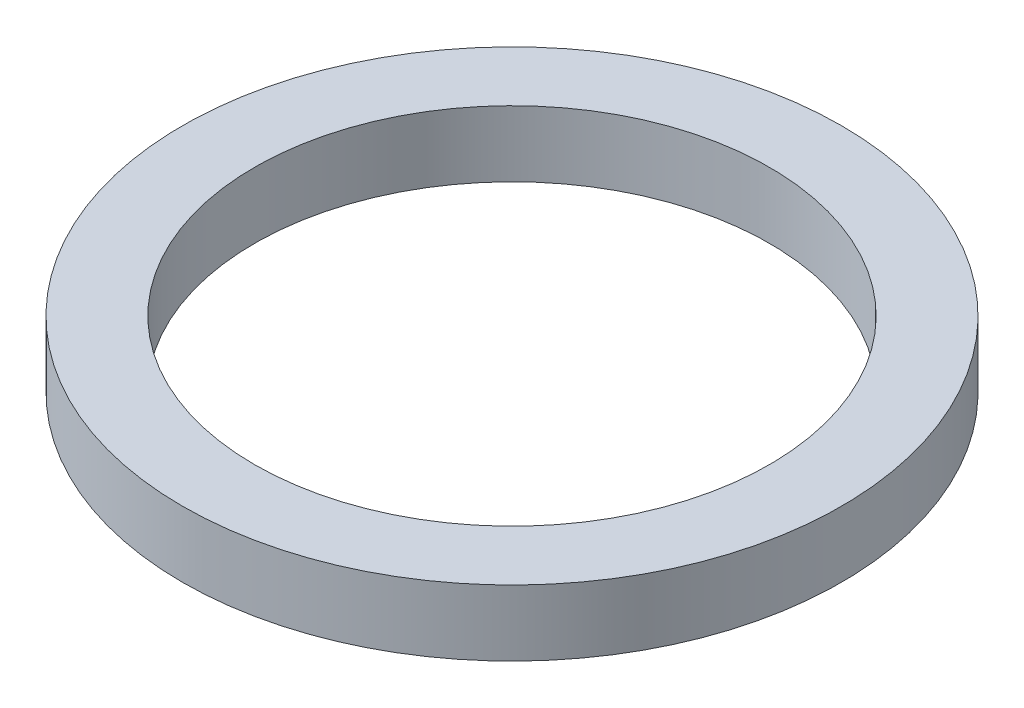
from build123d import *

# Parameters (mm, degrees)
SKETCH1_R           = 25
SKETCH1_R_2         = 19.534957879
BOSS_EXTRUDE1_DEPTH = 5


with BuildPart() as part:
    # Sketch1 → Boss-Extrude1 (new body)
    with BuildSketch(Plane(origin=(0, 0, 0), x_dir=(1, 0, 0), z_dir=(0, 1, 0))):
        with Locations(Location((0, 0, 0), (0, 0, 270))):
            Circle(SKETCH1_R)
        with Locations(Location((0, 0, 0), (0, 0, 270))):
            Circle(SKETCH1_R_2, mode=Mode.SUBTRACT)
    extrude(amount=BOSS_EXTRUDE1_DEPTH)


solid = part.part
